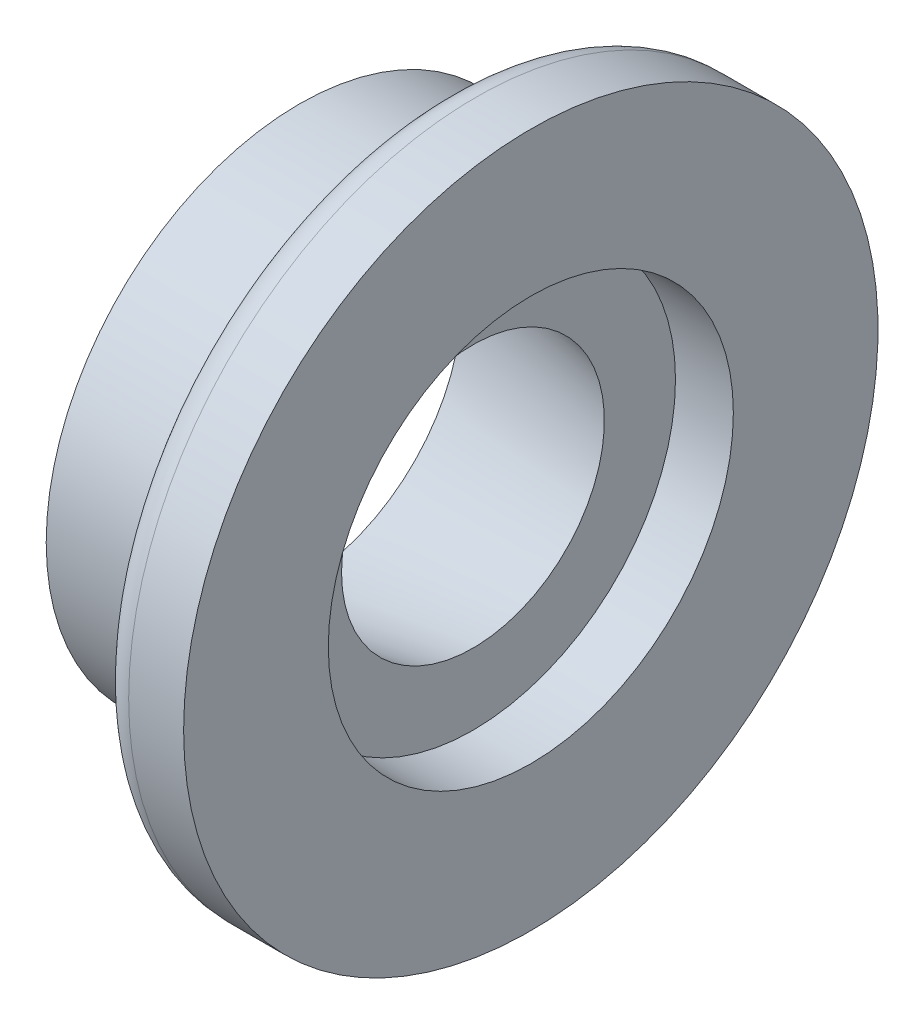
from build123d import *

# Parameters (mm, degrees)
CONG_1_R = 1.1


with BuildPart() as part:
    # Esquisse2 → Base-Révolution (revolve)
    with BuildSketch(Plane.XY, mode=Mode.PRIVATE) as base_r_volution_sk:
        Polygon((39.85, 4.542160182), (33.85, 5.600122066), (33.85, 8.75), (38.85, 8.75), (38.85, 12), (41.85, 12), (41.85, 7), (39.85, 7), align=None)
    revolve(base_r_volution_sk.sketch.rotate(Axis((0, 0, 0), (1, 0, 0)), 90), axis=Axis((0, 0, 0), (1, 0, 0)))

    # Congé1
    cong_1_edges = [part.edges().sort_by_distance(p)[0] for p in [
        (38.85, 0, -8.75),
        (38.85, 0, -12),
    ]]
    fillet(cong_1_edges, radius=CONG_1_R)


solid = part.part
